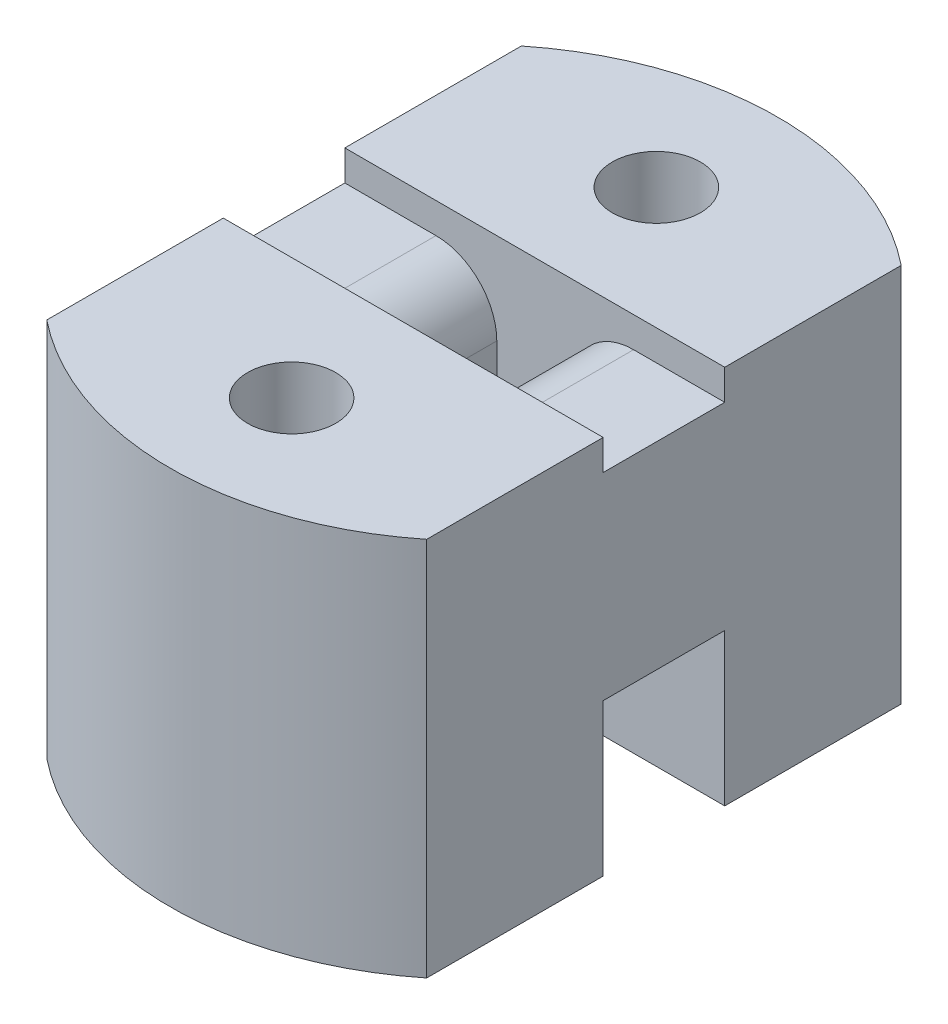
from build123d import *

# Parameters (mm, degrees)
SKETCH1_R               = 20
BOSS_EXTRUDE1_DEPTH     = 25
SKETCH2_W               = 40
SKETCH2_H               = 8
CUT_EXTRUDE1_DEPTH      = 2
M5_CLEARANCE_HOLE1_D    = 5.8
CUT_EXTRUDE2_DEPTH      = 6
CUT_EXTRUDE3_DEPTH      = 37.455452267
CUT_EXTRUDE3_DEPTH_BACK = 37.455452267
SKETCH6_W               = 5
SKETCH6_H               = 8
SKETCH7_W               = 40
SKETCH7_H               = 8
CUT_EXTRUDE4_DEPTH      = 10
FILLET1_R               = 4
SKETCH8_OUTSIDE_W       = 54.37
SKETCH8_OUTSIDE_H       = 54.37
SKETCH8_OUTSIDE_W_2     = 25
SKETCH8_OUTSIDE_H_2     = 40
CUT_EXTRUDE5_DEPTH      = 38.749172176


with BuildPart() as part:
    # Sketch1 → Boss-Extrude1 (new body)
    with BuildSketch(Plane(origin=(0, 0, 0), x_dir=(1, 0, 0), z_dir=(0, 1, 0))):
        with Locations(Location((0, 0, 0), (0, 0, 270))):
            Circle(SKETCH1_R)
    extrude(amount=BOSS_EXTRUDE1_DEPTH)

    # Sketch2 → Cut-Extrude1 (cut)
    with BuildSketch(Plane(origin=(0, 25, 0), x_dir=(1, 0, 0), z_dir=(0, 1, 0))):
        Rectangle(SKETCH2_W, SKETCH2_H)
    extrude(amount=-CUT_EXTRUDE1_DEPTH, mode=Mode.SUBTRACT)

    # M5 Clearance Hole1 (through all)
    with Locations(Plane(origin=(0, 25, -12), x_dir=(0, 0, 1), z_dir=(0, 1, 0))):
        with Locations((0, 0), (24, 0)):
            Hole(M5_CLEARANCE_HOLE1_D / 2)

    # Sketch5 → Cut-Extrude2 (cut)
    with BuildSketch(Plane.XZ):
        Polygon((4.907477288, 12), (2.453738644, 16.25), (-2.453738644, 16.25), (-4.907477288, 12), (-2.453738644, 7.75), (2.453738644, 7.75), align=None)
        Polygon((4.907477288, -12), (2.453738644, -7.75), (-2.453738644, -7.75), (-4.907477288, -12), (-2.453738644, -16.25), (2.453738644, -16.25), align=None)
    extrude(amount=-CUT_EXTRUDE2_DEPTH, mode=Mode.SUBTRACT)

    # Sketch6 → Cut-Extrude3 (cut, two sides: drawn at the far end of the back side and taken through both)
    with BuildSketch(Plane(origin=(0, 23, 0), x_dir=(1, 0, 0), z_dir=(0, 1, 0)).offset(-CUT_EXTRUDE3_DEPTH_BACK)):
        Rectangle(SKETCH6_W, SKETCH6_H)
    extrude(amount=CUT_EXTRUDE3_DEPTH + CUT_EXTRUDE3_DEPTH_BACK, mode=Mode.SUBTRACT)

    # Sketch7 → Cut-Extrude4 (cut)
    with BuildSketch(Plane.XZ):
        Rectangle(SKETCH7_W, SKETCH7_H)
    extrude(amount=-CUT_EXTRUDE4_DEPTH, mode=Mode.SUBTRACT)

    # Fillet1
    fillet1_edges = [part.edges().sort_by_distance(p)[0] for p in [
        (2.5, 10, 0),
        (-2.5, 10, 0),
        (-2.5, 23, 0),
        (2.5, 23, 0),
    ]]
    fillet(fillet1_edges, radius=FILLET1_R)

    # Sketch8 outside → Cut-Extrude5 (cut, through all)
    with BuildSketch(Plane(origin=(0, 25, 0), x_dir=(1, 0, 0), z_dir=(0, 1, 0))):
        Rectangle(SKETCH8_OUTSIDE_W, SKETCH8_OUTSIDE_H)
        Rectangle(SKETCH8_OUTSIDE_W_2, SKETCH8_OUTSIDE_H_2, mode=Mode.SUBTRACT)
    extrude(amount=-CUT_EXTRUDE5_DEPTH, mode=Mode.SUBTRACT)


solid = part.part
